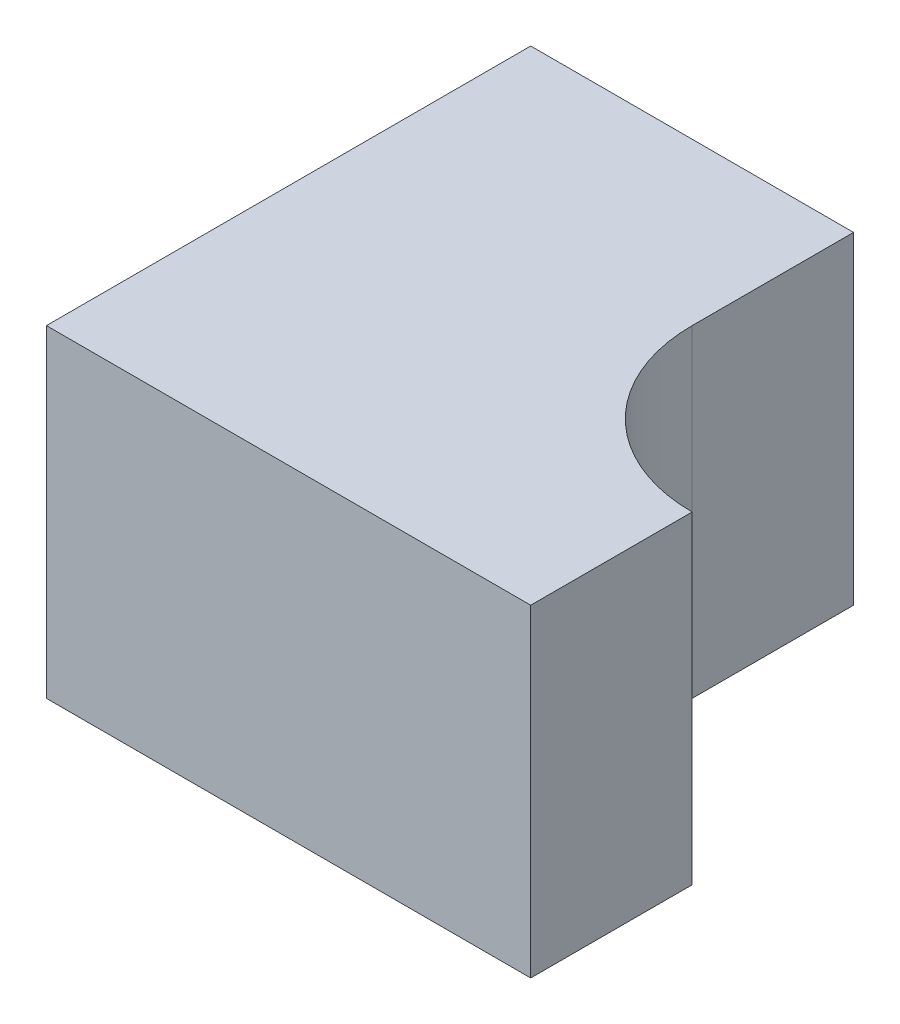
from build123d import *

# Parameters (mm, degrees)
BOSS_EXTRUDE1_DEPTH = 20


with BuildPart() as part:
    # Sketch2 → Boss-Extrude1 (new body)
    with BuildSketch(Plane(origin=(0, 0, 0), x_dir=(1, 0, 0), z_dir=(0, 1, 0))):
        with BuildLine():
            Line((0, 0), (0, -10))
            ThreePointArc((0, -10), (2.928932188, -17.071067812), (10, -20))
            Line((10, -20), (10, -30))
            Line((10, -30), (-20, -30))
            Line((-20, -30), (-20, 0))
            Line((-20, 0), (0, 0))
        make_face()
    extrude(amount=BOSS_EXTRUDE1_DEPTH)


solid = part.part
